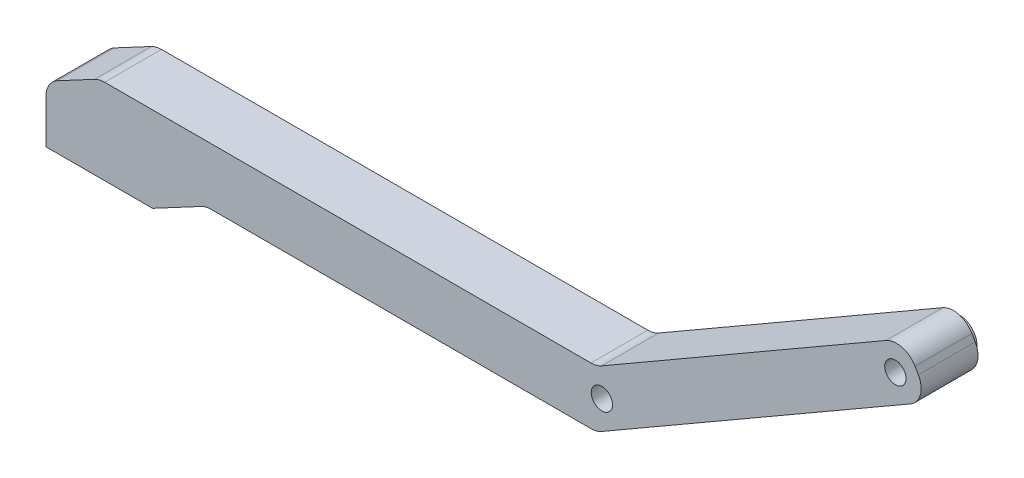
from build123d import *

# Parameters (mm, degrees)
SKETCH_1_R      = 1.5
EXTRUDE_1_DEPTH = 8
FILLET_1_R      = 3
EXTRUDE_START   = -9
SKETCH_2_R      = 2.5
SKETCH_2_R_2    = 1.5
EXTRUDE_2_DEPTH = 9


with BuildPart() as part:
    # 草图1 → 凸台-拉伸1 (new body)
    with BuildSketch(Plane.XY):
        Polygon((-7.5, 4), (-7.5, -4), (7.5, -4), (15, 0), (70, 0), (116.765371804, 27), (113.301270189, 33), (70, 8), (0, 8), align=None)
        with Locations((112.0368731, 28.27)):
            Circle(SKETCH_1_R, mode=Mode.SUBTRACT)
        with Locations((70.727461339, 4.42)):
            Circle(SKETCH_1_R, mode=Mode.SUBTRACT)
    extrude(amount=EXTRUDE_1_DEPTH)

    # 圆角1
    fillet_1_edges = [part.edges().sort_by_distance(p)[0] for p in [
        (-7.5, 4, 4),
        (0, 8, 4),
        (70, 8, 4),
        (113.301270189, 33, 4),
        (116.765371804, 27, 4),
        (70, 0, 4),
        (15, 0, 4),
    ]]
    fillet(fillet_1_edges, radius=FILLET_1_R)

    # 草图2 → 凸台-拉伸2 (add)
    with BuildSketch(Plane.XY.offset(8).offset(EXTRUDE_START)):
        with Locations((112.0368731, 28.27)):
            Circle(SKETCH_2_R)
        with Locations((112.0368731, 28.27)):
            Circle(SKETCH_2_R_2, mode=Mode.SUBTRACT)
    extrude(amount=EXTRUDE_2_DEPTH)


solid = part.part
